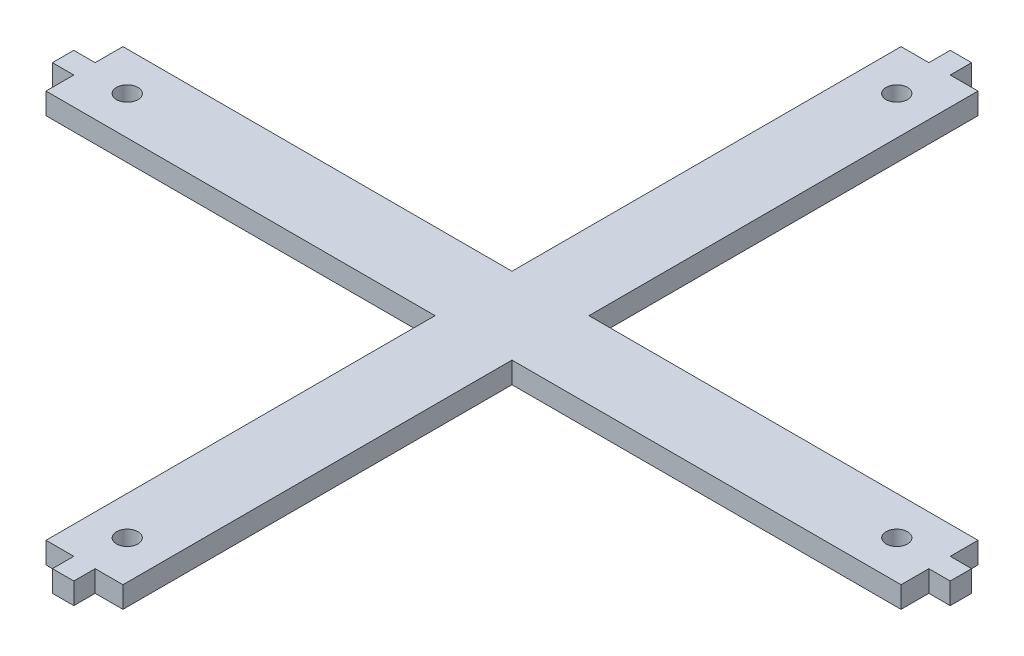
from build123d import *

# Parameters (mm, degrees)
SKETCH1_R           = 3.175
BOSS_EXTRUDE1_DEPTH = 6.35


with BuildPart() as part:
    # Sketch1 → Boss-Extrude1 (new body)
    with BuildSketch(Plane(origin=(0, 0, 0), x_dir=(1, 0, 0), z_dir=(0, 1, 0))):
        Polygon((-127, -3.175), (-127, -11.43), (-11.43, -11.43), (-11.43, -127), (-3.175, -127), (-3.175, -133.35), (3.175, -133.35), (3.175, -127), (11.43, -127), (11.43, -11.43), (127, -11.43), (127, -3.175), (133.35, -3.175), (133.35, 3.175), (127, 3.175), (127, 11.43), (11.43, 11.43), (11.43, 127), (3.175, 127), (3.175, 133.35), (-3.175, 133.35), (-3.175, 127), (-11.43, 127), (-11.43, 11.43), (-127, 11.43), (-127, 3.175), (-133.35, 3.175), (-133.35, -3.175), align=None)
        with Locations(Location((-114.3, 0, 0), (0, 0, 270))):
            Circle(SKETCH1_R, mode=Mode.SUBTRACT)
        with Locations(Location((114.3, 0, 0), (0, 0, 270))):
            Circle(SKETCH1_R, mode=Mode.SUBTRACT)
        with Locations(Location((0, 114.3, 0), (0, 0, 270))):
            Circle(SKETCH1_R, mode=Mode.SUBTRACT)
        with Locations(Location((0, -114.3, 0), (0, 0, 270))):
            Circle(SKETCH1_R, mode=Mode.SUBTRACT)
    extrude(amount=BOSS_EXTRUDE1_DEPTH)


solid = part.part
